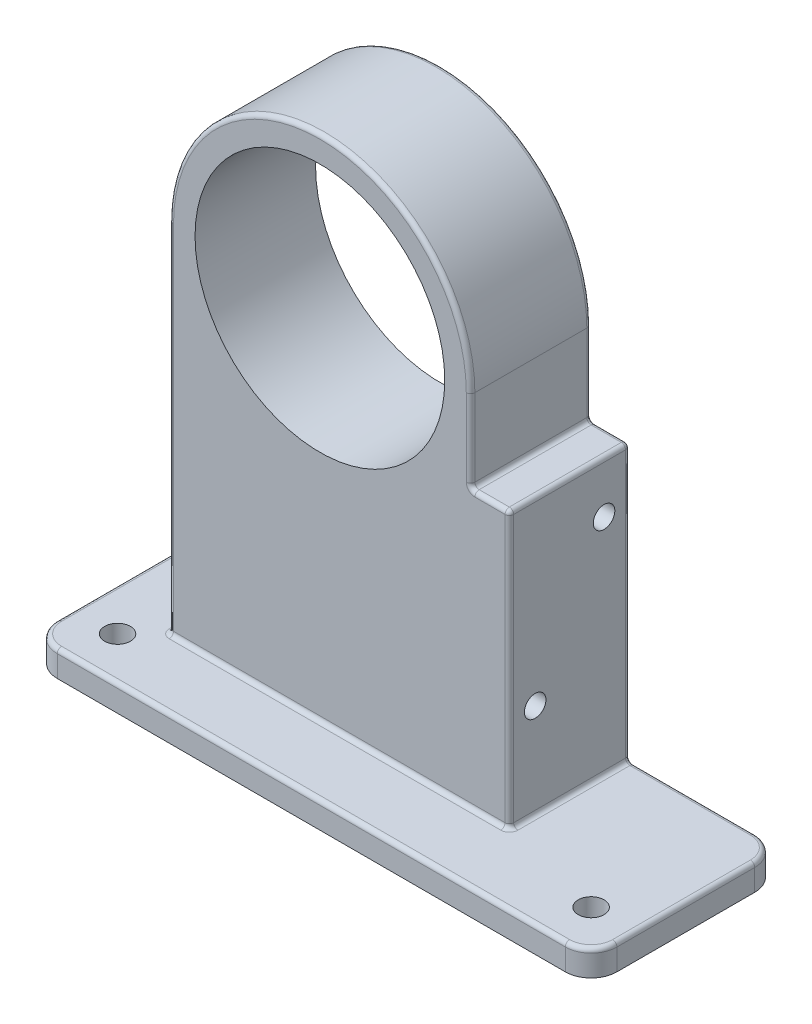
from build123d import *

# Parameters (mm, degrees)
SKETCH1_R                 = 1.5
BOSS_EXTRUDE1_DEPTH       = 3
SKETCH3_R                 = 14.5
BOSS_EXTRUDE2_DEPTH       = 14
M3X0_5_TAPPED_HOLE1_D     = 2.5
M3X0_5_TAPPED_HOLE1_DEPTH = 10.748924226
M3X0_5_TAPPED_HOLE1_TIP   = 0.751075774
FILLET2_R                 = 0.5


with BuildPart() as part:
    # Sketch1 → Boss-Extrude1 (new body)
    with BuildSketch(Plane(origin=(0, 0, 0), x_dir=(1, 0, 0), z_dir=(0, 1, 0))):
        with BuildLine():
            Line((-29.5, -11), (29.5, -11))
            ThreePointArc((29.5, -11), (31.621320344, -10.121320344), (32.5, -8))
            Line((32.5, -8), (32.5, 8))
            ThreePointArc((32.5, 8), (31.621320344, 10.121320344), (29.5, 11))
            Line((29.5, 11), (-29.5, 11))
            ThreePointArc((-29.5, 11), (-31.621320344, 10.121320344), (-32.5, 8))
            Line((-32.5, 8), (-32.5, -8))
            ThreePointArc((-32.5, -8), (-31.621320344, -10.121320344), (-29.5, -11))
        make_face()
        with Locations(Location((-27.5, -6, 0), (0, 0, 270))):
            Circle(SKETCH1_R, mode=Mode.SUBTRACT)
        with Locations(Location((27.5, -6, 0), (0, 0, 270))):
            Circle(SKETCH1_R, mode=Mode.SUBTRACT)
    extrude(amount=BOSS_EXTRUDE1_DEPTH)

    # Sketch3 → Boss-Extrude2 (add)
    with BuildSketch(Plane(origin=(0, 0, -11), x_dir=(-1, 0, 0), z_dir=(0, 0, -1))):
        with BuildLine():
            Line((24.5, 3), (24.5, 44.5))
            ThreePointArc((24.5, 44.5), (7, 62), (-10.5, 44.5))
            Line((-10.5, 44.5), (-10.5, 35))
            Line((-10.5, 35), (-15, 35))
            Line((-15, 35), (-15, 3))
            Line((-15, 3), (24.5, 3))
        make_face()
        with Locations((7, 44.5)):
            Circle(SKETCH3_R, mode=Mode.SUBTRACT)
    extrude(amount=-BOSS_EXTRUDE2_DEPTH)

    # M3x0.5 Tapped Hole1
    with Locations(Plane(origin=(15, 0, 0), x_dir=(0, 0, -1), z_dir=(1, 0, 0))):
        with Locations((0, 14), (8, 29)):
            Hole(M3X0_5_TAPPED_HOLE1_D / 2, depth=M3X0_5_TAPPED_HOLE1_DEPTH)
            with Locations((0, 0, -(M3X0_5_TAPPED_HOLE1_DEPTH + M3X0_5_TAPPED_HOLE1_TIP / 2))):  # 118° drill point
                Cone(0, M3X0_5_TAPPED_HOLE1_D / 2, M3X0_5_TAPPED_HOLE1_TIP, mode=Mode.SUBTRACT)

    # Fillet2
    fillet2_edges = [part.edges().sort_by_distance(p)[0] for p in [
        (-31.621320344, 3, -10.121320344),
        (-32.5, 3, 0),
        (-31.621320344, 3, 10.121320344),
        (0, 3, 11),
        (31.621320344, 3, 10.121320344),
        (32.5, 3, 0),
        (-27, 3, -11),
        (-24.5, 23.75, -11),
        (-24.5, 3, -4),
        (15, 19, 3),
        (15, 3, -4),
        (12.75, 35, 3),
        (15, 35, -4),
        (10.5, 39.75, 3),
        (10.5, 35, -4),
        (-7, 62, 3),
        (-24.5, 23.75, 3),
        (-4.75, 3, 3),
        (-7, 62, -11),
        (10.5, 39.75, -11),
        (12.75, 35, -11),
        (15, 19, -11),
        (31.621320344, 3, -10.121320344),
        (22.25, 3, -11),
    ]]
    fillet(fillet2_edges, radius=FILLET2_R)


solid = part.part
